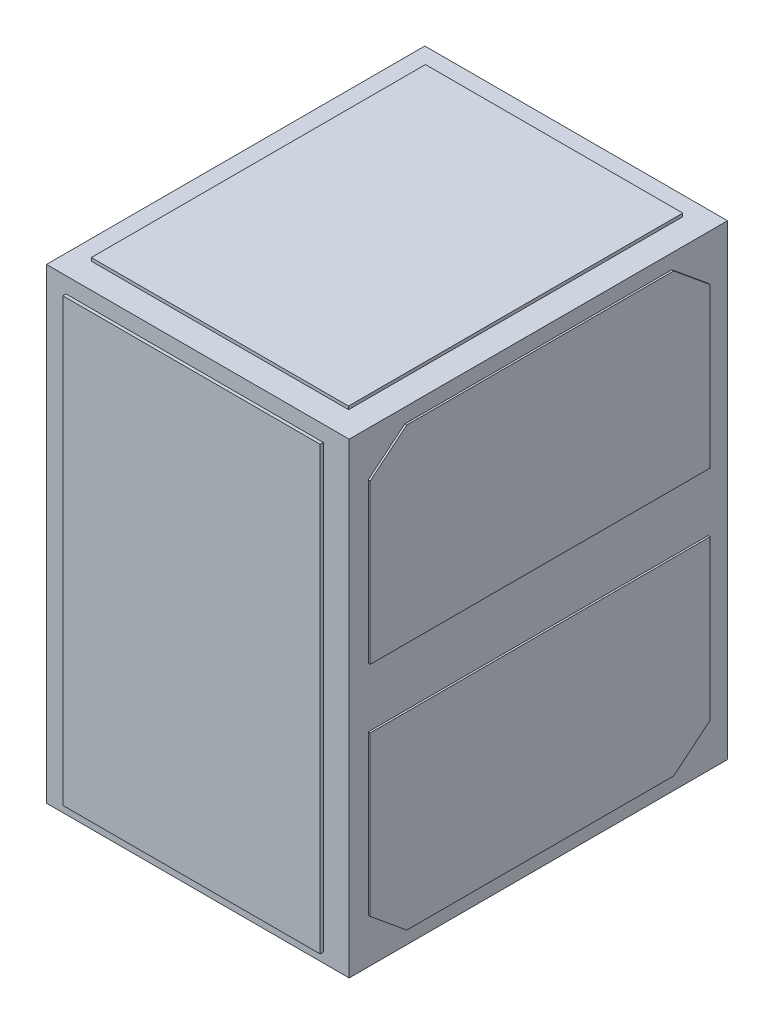
from build123d import *

# Parameters (mm, degrees)
SKETCH1_W            = 240
SKETCH1_H            = 300
BOSS_EXTRUDE1_DEPTH  = 370
SKETCH2_R            = 4.3
BOSS_EXTRUDE2_DEPTH  = 2.5
SKETCH3_W            = 204
SKETCH3_H            = 265
BOSS_EXTRUDE3_DEPTH  = 2.5
SKETCH8_R            = 4.286085294
BOSS_EXTRUDE6_DEPTH  = 2.5
SKETCH9_W            = 204
SKETCH9_H            = 265
BOSS_EXTRUDE7_DEPTH  = 2.5
SKETCH10_R           = 4.3
BOSS_EXTRUDE8_DEPTH  = 2.5
SKETCH12_W           = 204
SKETCH12_H           = 350
BOSS_EXTRUDE9_DEPTH  = 2.5
BOSS_EXTRUDE10_START = 2.5
SKETCH13_R           = 4.3
BOSS_EXTRUDE10_DEPTH = 2.5
SKETCH14_W           = 204
SKETCH14_H           = 350
BOSS_EXTRUDE11_DEPTH = 2.5
BOSS_EXTRUDE12_DEPTH = 1.5
BOSS_EXTRUDE13_DEPTH = 1.5


with BuildPart() as part:
    # Sketch1 → Boss-Extrude1 (new body)
    with BuildSketch(Plane(origin=(0, 0, 0), x_dir=(1, 0, 0), z_dir=(0, 1, 0))):
        Rectangle(SKETCH1_W, SKETCH1_H)
    extrude(amount=BOSS_EXTRUDE1_DEPTH)

    # Sketch2 → Boss-Extrude2 (add)
    with BuildSketch(Plane(origin=(0, 370, 0), x_dir=(1, 0, 0), z_dir=(0, 1, 0))):
        with Locations(Location((-86, 120, 0), (0, 0, 90))):
            Circle(SKETCH2_R)
        with Locations(Location((86, 120, 0), (0, 0, 90))):
            Circle(SKETCH2_R)
        with Locations(Location((86, -120, 0), (0, 0, 90))):
            Circle(SKETCH2_R)
        with Locations(Location((-86, -120, 0), (0, 0, 90))):
            Circle(SKETCH2_R)
    extrude(amount=BOSS_EXTRUDE2_DEPTH)

    # Sketch3 → Boss-Extrude3 (add)
    with BuildSketch(Plane(origin=(0, 372.5, 0), x_dir=(1, 0, 0), z_dir=(0, 1, 0))):
        Rectangle(SKETCH3_W, SKETCH3_H)
    extrude(amount=BOSS_EXTRUDE3_DEPTH)

    # Sketch8 → Boss-Extrude6 (add)
    with BuildSketch(Plane.XZ):
        with Locations(Location((-86, 120, 0), (0, 0, 270))):
            Circle(SKETCH8_R)
        with Locations(Location((86, 120, 0), (0, 0, 270))):
            Circle(SKETCH8_R)
        with Locations(Location((86, -120, 0), (0, 0, 270))):
            Circle(SKETCH8_R)
        with Locations(Location((-86, -120, 0), (0, 0, 270))):
            Circle(SKETCH8_R)
    extrude(amount=BOSS_EXTRUDE6_DEPTH)

    # Sketch9 → Boss-Extrude7 (add)
    with BuildSketch(Plane.XZ.offset(2.5)):
        Rectangle(SKETCH9_W, SKETCH9_H)
    extrude(amount=BOSS_EXTRUDE7_DEPTH)

    # Sketch10 → Boss-Extrude8 (add)
    with BuildSketch(Plane.XY.offset(150)):
        with Locations(Location((-86, 345, 0), (0, 0, 180))):
            Circle(SKETCH10_R)
        with Locations(Location((86, 345, 0), (0, 0, 180))):
            Circle(SKETCH10_R)
        with Locations(Location((86, 25, 0), (0, 0, 180))):
            Circle(SKETCH10_R)
        with Locations(Location((-86, 25, 0), (0, 0, 180))):
            Circle(SKETCH10_R)
    extrude(amount=BOSS_EXTRUDE8_DEPTH)

    # Sketch12 → Boss-Extrude9 (add)
    with BuildSketch(Plane.XY.offset(152.5)):
        with Locations((0, 185)):
            Rectangle(SKETCH12_W, SKETCH12_H)
    extrude(amount=BOSS_EXTRUDE9_DEPTH)

    # Sketch13 → Boss-Extrude10 (add)
    with BuildSketch(Plane(origin=(0, 0, -150), x_dir=(-1, 0, 0), z_dir=(0, 0, -1)).offset(BOSS_EXTRUDE10_START)):
        with Locations((-86, 345)):
            Circle(SKETCH13_R)
        with Locations((86, 345)):
            Circle(SKETCH13_R)
        with Locations((-86, 25)):
            Circle(SKETCH13_R)
        with Locations((86, 25)):
            Circle(SKETCH13_R)
    extrude(amount=-BOSS_EXTRUDE10_DEPTH)

    # Sketch14 → Boss-Extrude11 (add)
    with BuildSketch(Plane(origin=(0, 0, -152.5), x_dir=(-1, 0, 0), z_dir=(0, 0, -1))):
        with Locations((0, 185)):
            Rectangle(SKETCH14_W, SKETCH14_H)
    extrude(amount=BOSS_EXTRUDE11_DEPTH)

    # Sketch15 → Boss-Extrude12 (add)
    with BuildSketch(Plane.ZY.offset(120)):
        Polygon((-134.788231979, 161.45540947), (134.788231979, 161.45540947), (134.788231979, 35.45540947), (105.855505742, 11.598600117), (-105.855505742, 11.598600117), (-134.788231979, 35.45540947), align=None)
        Polygon((-134.788231979, 334.54459053), (-105.855505742, 358.401399883), (105.855505742, 358.401399883), (134.788231979, 334.54459053), (134.788231979, 208.54459053), (-134.788231979, 208.54459053), align=None)
    extrude(amount=BOSS_EXTRUDE12_DEPTH)

    # Sketch17 → Boss-Extrude13 (add)
    with BuildSketch(Plane(origin=(120, 0, 0), x_dir=(0, 0, -1), z_dir=(1, 0, 0))):
        Polygon((-134.788231979, 208.54459053), (134.788231979, 208.54459053), (134.788231979, 334.54459053), (105.855505742, 358.401399883), (-105.855505742, 358.401399883), (-134.788231979, 334.54459053), align=None)
        Polygon((-134.788231979, 161.45540947), (134.788231979, 161.45540947), (134.788231979, 35.45540947), (105.855505742, 11.598600117), (-105.855505742, 11.598600117), (-134.788231979, 35.45540947), align=None)
    extrude(amount=BOSS_EXTRUDE13_DEPTH)


solid = part.part
